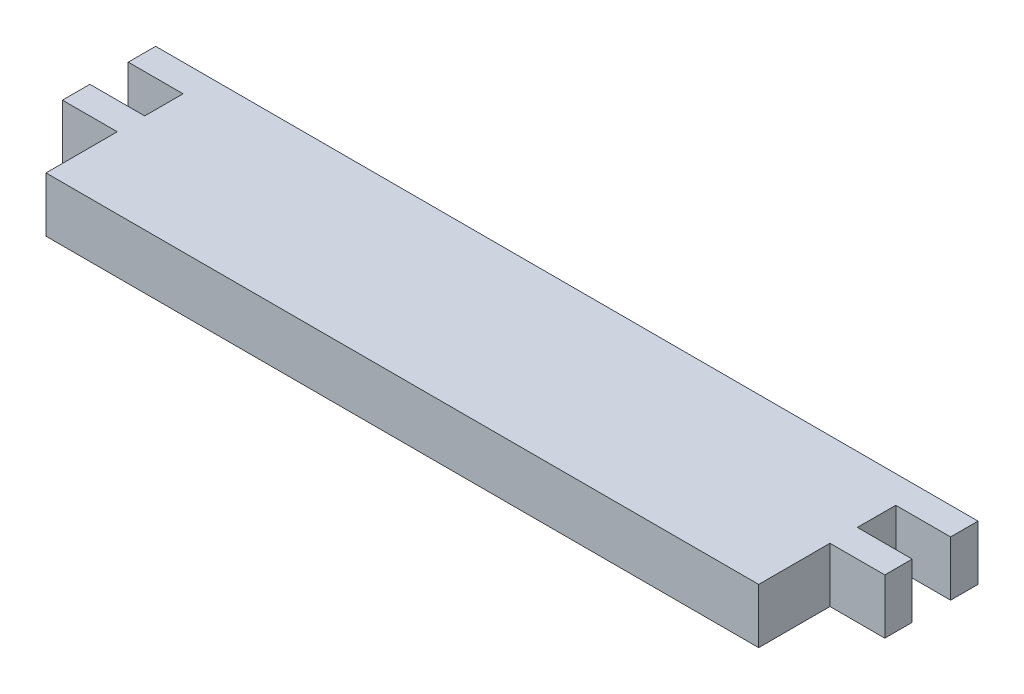
from build123d import *

# Parameters (mm, degrees)
SKETCH_1_W          = 130
SKETCH_1_H          = 10
EXTRUDE_1_DEPTH     = 7
SKETCH_2_W          = 150
SKETCH_2_H          = 10
EXTRUDE_2_DEPTH     = 5
SKETCH_5_W          = 130
SKETCH_5_H          = 10
EXTRUDE_4_DEPTH     = 18
SKETCH_3_W          = 30
SKETCH_3_H          = 18
CUT_EXTRUDE_1_DEPTH = 4
SKETCH_6_W          = 5
SKETCH_6_H          = 10
EXTRUDE_5_DEPTH     = 10


with BuildPart() as part:
    # 스케치1 → 보스-돌출1 (new body)
    with BuildSketch(Plane.XY):
        Rectangle(SKETCH_1_W, SKETCH_1_H)
    extrude(amount=EXTRUDE_1_DEPTH)

    # 스케치2 → 보스-돌출2 (add)
    with BuildSketch(Plane(origin=(0, 0, 0), x_dir=(-1, 0, 0), z_dir=(0, 0, -1))):
        Rectangle(SKETCH_2_W, SKETCH_2_H)
    extrude(amount=EXTRUDE_2_DEPTH)

    # 스케치5 → 보스-돌출4 (add)
    with BuildSketch(Plane.XY.offset(7)):
        Rectangle(SKETCH_5_W, SKETCH_5_H)
    extrude(amount=EXTRUDE_4_DEPTH)

    # 스케치3 → 컷-돌출1 (cut)
    with BuildSketch(Plane(origin=(0, -5, 0), x_dir=(1, 0, 0), z_dir=(0, 1, 0))):
        with Locations((-44, -13)):
            Rectangle(SKETCH_3_W, SKETCH_3_H)
        with Locations((44, -13)):
            Rectangle(SKETCH_3_W, SKETCH_3_H)
    extrude(amount=CUT_EXTRUDE_1_DEPTH, mode=Mode.SUBTRACT)

    # 스케치6 → 보스-돌출5 (add)
    with BuildSketch(Plane.ZY.offset(65)):
        with Locations((9.5, 0)):
            Rectangle(SKETCH_6_W, SKETCH_6_H)
    extrude_5 = extrude(amount=EXTRUDE_5_DEPTH)

    # 대칭 복사1: 보스-돌출5 across plane
    add(extrude_5.mirror(Plane.ZY))


solid = part.part
